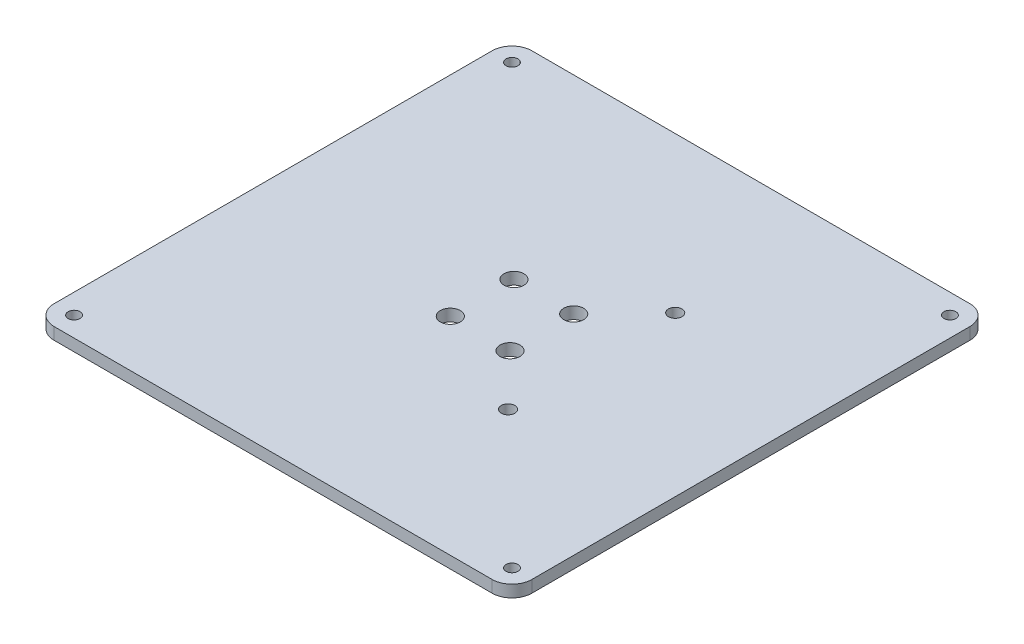
from build123d import *

# Parameters (mm, degrees)
SKETCH1_W                                  = 120
SKETCH1_H                                  = 120
SKETCH1_R                                  = 2.5
BOSS_EXTRUDE1_DEPTH                        = 3
FILLET1_R                                  = 5
SKETCH2_R                                  = 1.5
CUT_EXTRUDE1_DEPTH                         = 85.905830189
MIRROR3_AT_THE_SECOND_PLANE_COPY_1_SKETC_R = 1.5
MIRROR3_AT_THE_SECOND_PLANE_COPY_1_DEPTH   = 85.905830189
SKETCH3_R                                  = 1.7
CUT_EXTRUDE2_DEPTH                         = 85.905830189


with BuildPart() as part:
    # Sketch1 → Boss-Extrude1 (new body)
    with BuildSketch(Plane(origin=(0, 0, 0), x_dir=(1, 0, 0), z_dir=(0, 1, 0))):
        Rectangle(SKETCH1_W, SKETCH1_H)
        with Locations(Location((-7.5, -8, 0), (0, 0, 270))):
            Circle(SKETCH1_R, mode=Mode.SUBTRACT)
        with Locations(Location((7.5, 8, 0), (0, 0, 270))):
            Circle(SKETCH1_R, mode=Mode.SUBTRACT)
        with Locations(Location((7.5, -8, 0), (0, 0, 270))):
            Circle(SKETCH1_R, mode=Mode.SUBTRACT)
        with Locations(Location((-7.5, 8, 0), (0, 0, 270))):
            Circle(SKETCH1_R, mode=Mode.SUBTRACT)
    extrude(amount=BOSS_EXTRUDE1_DEPTH)

    # Fillet1
    fillet1_edges = [part.edges().sort_by_distance(p)[0] for p in [
        (60, 1.5, 60),
        (-60, 1.5, 60),
        (-60, 1.5, -60),
        (60, 1.5, -60),
    ]]
    fillet(fillet1_edges, radius=FILLET1_R)

    # Sketch2 → Cut-Extrude1 (cut, through all)
    with BuildSketch(Plane(origin=(0, 3, 0), x_dir=(1, 0, 0), z_dir=(0, 1, 0))):
        with Locations(Location((-55, 55, 0), (0, 0, 270))):
            Circle(SKETCH2_R)
    cut_extrude1 = extrude(amount=-CUT_EXTRUDE1_DEPTH, mode=Mode.SUBTRACT)

    # Mirror3: Cut-Extrude1 across plane
    add(cut_extrude1.mirror(Plane.XY), mode=Mode.SUBTRACT)

    # Mirror3 at the second plane: Cut-Extrude1 across plane
    add(cut_extrude1.mirror(Plane(origin=(0, 0, 0), x_dir=(0, 0, 1), z_dir=(1, 0, 0))), mode=Mode.SUBTRACT)

    # Mirror3 at the second plane copy 1 sketc → Mirror3 at the second plane copy 1 (cut, through all)
    with BuildSketch(Plane(origin=(0, 3, 0), x_dir=(-1, 0, 0), z_dir=(0, 1, 0))):
        with Locations(Location((-55, 55, 0), (0, 0, 270))):
            Circle(MIRROR3_AT_THE_SECOND_PLANE_COPY_1_SKETC_R)
    extrude(amount=-MIRROR3_AT_THE_SECOND_PLANE_COPY_1_DEPTH, mode=Mode.SUBTRACT)

    # Sketch3 → Cut-Extrude2 (cut, through all)
    with BuildSketch(Plane(origin=(0, 3, 0), x_dir=(1, 0, 0), z_dir=(0, 1, 0))):
        with Locations(Location((20, 21, 0), (0, 0, 270))):
            Circle(SKETCH3_R)
        with Locations(Location((20, -21, 0), (0, 0, 270))):
            Circle(SKETCH3_R)
    extrude(amount=-CUT_EXTRUDE2_DEPTH, mode=Mode.SUBTRACT)


solid = part.part
